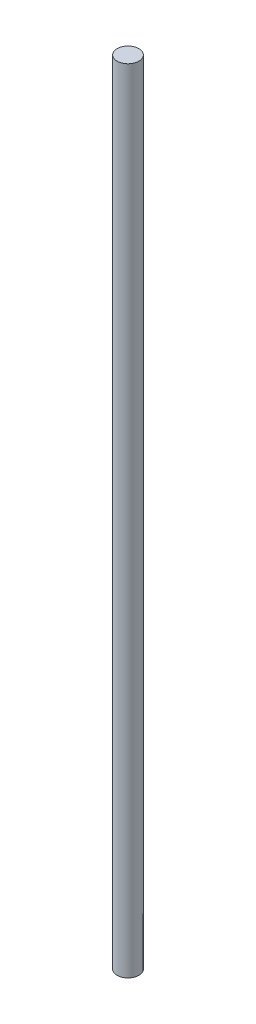
from build123d import *

# Parameters (mm, degrees)
SKETCH_1_R      = 2.75
EXTRUDE_1_DEPTH = 200


with BuildPart() as part:
    # 草图1 → 凸台-拉伸1 (new body)
    with BuildSketch(Plane(origin=(0, 0, 0), x_dir=(1, 0, 0), z_dir=(0, 1, 0))):
        with Locations(Location((0, 0, 0), (0, 0, 270))):
            Circle(SKETCH_1_R)
    extrude(amount=EXTRUDE_1_DEPTH)


solid = part.part
